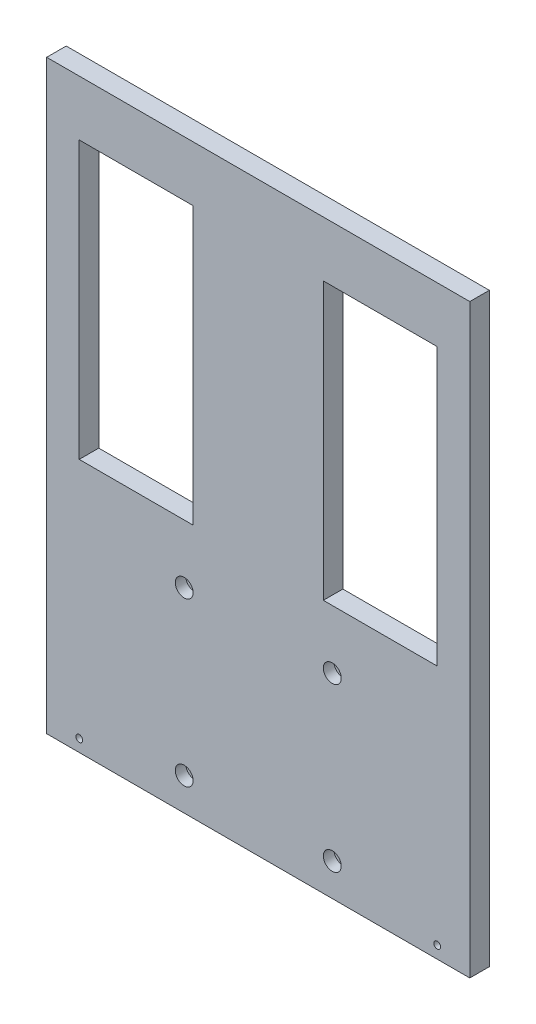
from build123d import *

# Parameters (mm, degrees)
SKETCH1_W               = 260
SKETCH1_H               = 360
BOSS_EXTRUDE1_DEPTH     = 12
CUT_EXTRUDE1_DEPTH      = 550.727205075
CUT_EXTRUDE1_DEPTH_BACK = 550.727205075
SKETCH2_R               = 3.3
SKETCH3_R               = 5.5
CUT_EXTRUDE3_DEPTH      = 6.5
CUT_EXTRUDE4_DEPTH      = 550.727205075
CUT_EXTRUDE4_DEPTH_BACK = 550.727205075
SKETCH4_R               = 2.1
CUT_EXTRUDE5_DEPTH      = 550.727205075
CUT_EXTRUDE5_DEPTH_BACK = 550.727205075
SKETCH5_W               = 70
SKETCH5_H               = 170


with BuildPart() as part:
    # Sketch1 → Boss-Extrude1 (new body)
    with BuildSketch(Plane.XY):
        with Locations((0, 354)):
            Rectangle(SKETCH1_W, SKETCH1_H)
    extrude(amount=BOSS_EXTRUDE1_DEPTH)

    # Sketch2 → Cut-Extrude1 (cut, two sides: drawn at the far end of the back side and taken through both)
    with BuildSketch(Plane.XY.offset(-CUT_EXTRUDE1_DEPTH_BACK)):
        with Locations((-45.5, 194)):
            Circle(SKETCH2_R)
        with Locations((-45.5, 294)):
            Circle(SKETCH2_R)
        with Locations((45.5, 194)):
            Circle(SKETCH2_R)
        with Locations((45.5, 294)):
            Circle(SKETCH2_R)
    extrude(amount=CUT_EXTRUDE1_DEPTH + CUT_EXTRUDE1_DEPTH_BACK, mode=Mode.SUBTRACT)

    # Sketch3 → Cut-Extrude3 (cut)
    with BuildSketch(Plane.XY.offset(12)):
        with Locations((-45.5, 194)):
            Circle(SKETCH3_R)
        with Locations((-45.5, 294)):
            Circle(SKETCH3_R)
        with Locations((45.5, 194)):
            Circle(SKETCH3_R)
        with Locations((45.5, 294)):
            Circle(SKETCH3_R)
    extrude(amount=-CUT_EXTRUDE3_DEPTH, mode=Mode.SUBTRACT)

    # Sketch4 → Cut-Extrude4 (cut, two sides: drawn at the far end of the back side and taken through both)
    with BuildSketch(Plane.XY.offset(-CUT_EXTRUDE4_DEPTH_BACK)):
        with Locations((-110, 181.5)):
            Circle(SKETCH4_R)
        with Locations((110, 181.5)):
            Circle(SKETCH4_R)
    extrude(amount=CUT_EXTRUDE4_DEPTH + CUT_EXTRUDE4_DEPTH_BACK, mode=Mode.SUBTRACT)

    # Sketch5 → Cut-Extrude5 (cut, two sides: drawn at the far end of the back side and taken through both)
    with BuildSketch(Plane.XY.offset(-CUT_EXTRUDE5_DEPTH_BACK)):
        with Locations((-75, 415)):
            Rectangle(SKETCH5_W, SKETCH5_H)
        with Locations((75, 415)):
            Rectangle(SKETCH5_W, SKETCH5_H)
    extrude(amount=CUT_EXTRUDE5_DEPTH + CUT_EXTRUDE5_DEPTH_BACK, mode=Mode.SUBTRACT)


solid = part.part
